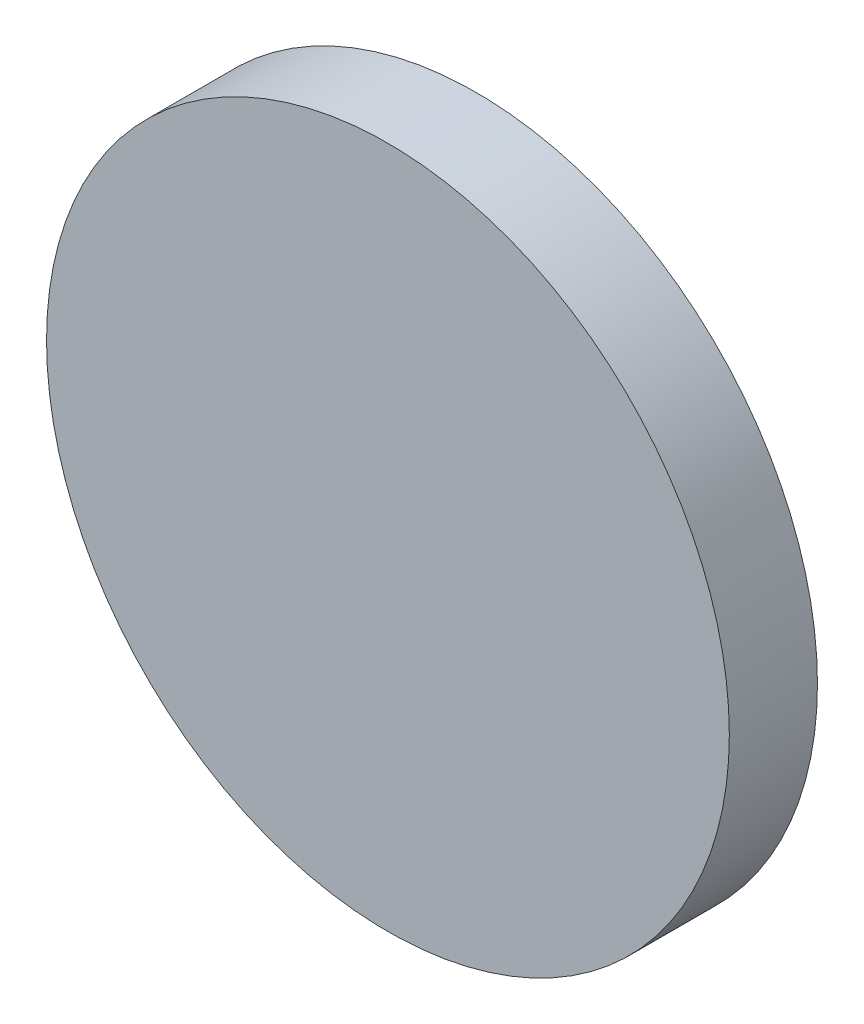
from build123d import *

# Parameters (mm, degrees)
SKETCH2_R           = 9.838697239
BOSS_EXTRUDE1_DEPTH = 2.54


with BuildPart() as part:
    # Sketch2 → Boss-Extrude1 (new body)
    with BuildSketch(Plane.XY):
        with Locations((4.081140652, -9.676564685)):
            Circle(SKETCH2_R)
    extrude(amount=BOSS_EXTRUDE1_DEPTH)


solid = part.part
